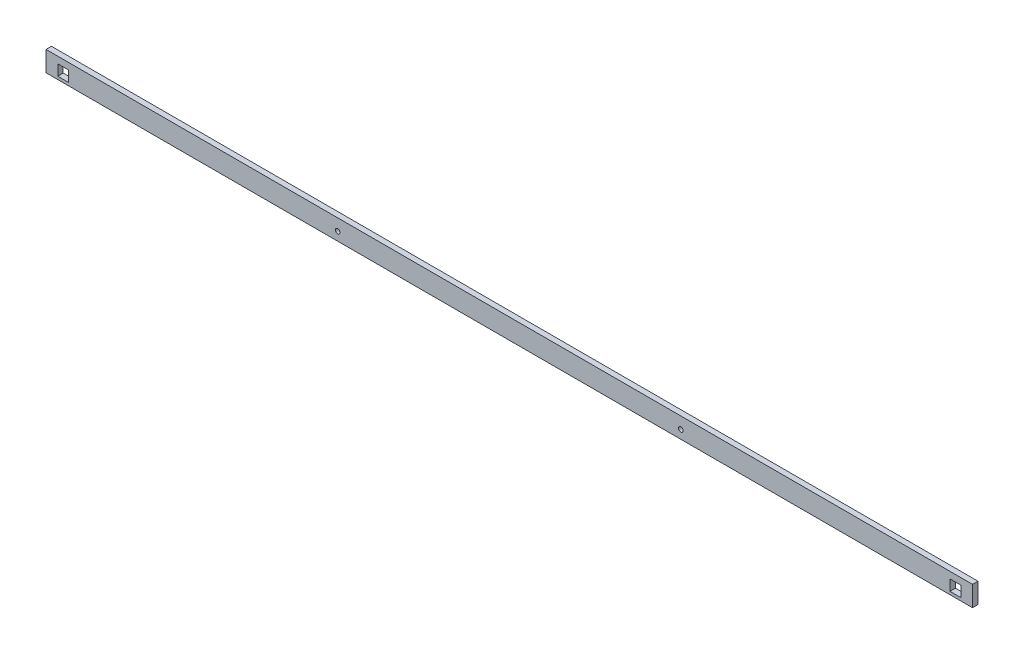
from build123d import *

# Parameters (mm, degrees)
SKETCH1_W           = 540
SKETCH1_H           = 11.8
BOSS_EXTRUDE1_DEPTH = 3.18
CUT_EXTRUDE1_REACH  = 272.083
SKETCH2_W           = 6.28
SKETCH2_H           = 6.28
CUT_EXTRUDE2_REACH  = 272.083
SKETCH3_R           = 1.35


with BuildPart() as part:
    # Sketch1 → Boss-Extrude1 (new body)
    with BuildSketch(Plane.XY):
        Rectangle(SKETCH1_W, SKETCH1_H)
    extrude(amount=BOSS_EXTRUDE1_DEPTH)

    # Sketch2 → Cut-Extrude1 (cut, up to next)
    with BuildSketch(Plane.XY.offset(3.18), mode=Mode.PRIVATE) as cut_extrude1_sk1:
        with Locations((260, -1.05)):
            Rectangle(SKETCH2_W, SKETCH2_H)
    cut_extrude1_tool1 = extrude(cut_extrude1_sk1.sketch, amount=-CUT_EXTRUDE1_REACH, mode=Mode.PRIVATE) & part.part
    cut_extrude1 = cut_extrude1_tool1.solids().sort_by_distance((260, -1.05, 3.18))[0]
    add(cut_extrude1, mode=Mode.SUBTRACT)

    # Mirror1: Cut-Extrude1 across plane
    add(cut_extrude1.mirror(Plane(origin=(0, 0, 0), x_dir=(0, 0, 1), z_dir=(1, 0, 0))), mode=Mode.SUBTRACT)

    # Sketch3 → Cut-Extrude2 (cut, up to next)
    with BuildSketch(Plane.XY.offset(3.18), mode=Mode.PRIVATE) as cut_extrude2_sk1:
        with Locations((100, -0.9)):
            Circle(SKETCH3_R)
    cut_extrude2_tool1 = extrude(cut_extrude2_sk1.sketch, amount=-CUT_EXTRUDE2_REACH, mode=Mode.PRIVATE) & part.part
    cut_extrude2 = cut_extrude2_tool1.solids().sort_by_distance((100, -0.9, 3.18))[0]
    add(cut_extrude2, mode=Mode.SUBTRACT)

    # Mirror2: Cut-Extrude2 across plane
    add(cut_extrude2.mirror(Plane(origin=(0, 0, 0), x_dir=(0, 0, 1), z_dir=(1, 0, 0))), mode=Mode.SUBTRACT)


solid = part.part
